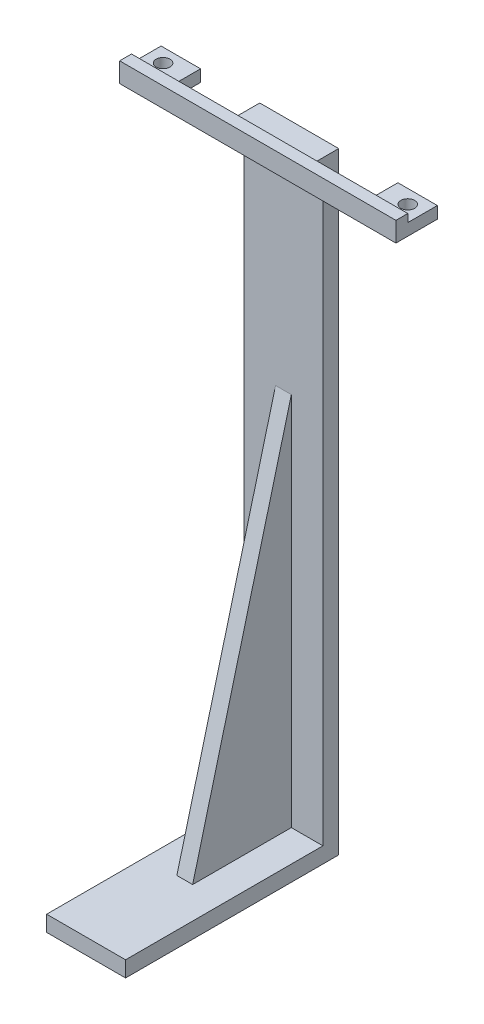
from build123d import *

# Parameters (mm, degrees)
SKETCH1_W           = 20
SKETCH1_H           = 155
BOSS_EXTRUDE1_DEPTH = 4
SKETCH2_W           = 20
SKETCH2_H           = 4
BOSS_EXTRUDE3_DEPTH = 50
RIB2_REACH          = 96.986
SKETCH7_WALL_W      = 290.205463948
SKETCH7_WALL_H      = 4
SKETCH8_W           = 20
SKETCH8_H           = 3
BOSS_EXTRUDE4_DEPTH = 3.5
SKETCH9_W           = 70
SKETCH9_H           = 5
BOSS_EXTRUDE6_DEPTH = 3
SKETCH10_W          = 10
SKETCH10_H          = 3
BOSS_EXTRUDE7_DEPTH = 7.5
SKETCH12_R          = 1.75
CUT_EXTRUDE1_DEPTH  = 10


with BuildPart() as part:
    # Sketch1 → Boss-Extrude1 (new body)
    with BuildSketch(Plane.XY):
        Rectangle(SKETCH1_W, SKETCH1_H)
    extrude(amount=BOSS_EXTRUDE1_DEPTH)

    # Sketch2 → Boss-Extrude3 (add)
    with BuildSketch(Plane.XY.offset(4)):
        with Locations((0, -75.5)):
            Rectangle(SKETCH2_W, SKETCH2_H)
    extrude(amount=BOSS_EXTRUDE3_DEPTH)

    # Sketch7 wall → Rib2 (add, up to next)
    with BuildSketch(Plane(origin=(0, -26, 16.5), x_dir=(0, 0.967074537263, -0.25449329928), z_dir=(0, 0.25449329928, 0.967074537263)), mode=Mode.PRIVATE) as rib2_sk1:
        Rectangle(SKETCH7_WALL_W, SKETCH7_WALL_H)
    rib2_tool1 = extrude(rib2_sk1.sketch, amount=-RIB2_REACH, mode=Mode.PRIVATE) - part.part
    add(rib2_tool1.solids().sort_by_distance((0, -26, 16.5))[0])

    # Sketch8 → Boss-Extrude4 (add)
    with BuildSketch(Plane.XY.offset(4)):
        with Locations((0, 76)):
            Rectangle(SKETCH8_W, SKETCH8_H)
    extrude(amount=BOSS_EXTRUDE4_DEPTH)

    # Sketch9 → Boss-Extrude6 (add)
    with BuildSketch(Plane.XY.offset(7.5)):
        with Locations((0, 77)):
            Rectangle(SKETCH9_W, SKETCH9_H)
    extrude(amount=BOSS_EXTRUDE6_DEPTH)

    # Sketch10 → Boss-Extrude7 (add)
    with BuildSketch(Plane(origin=(0, 0, 7.5), x_dir=(-1, 0, 0), z_dir=(0, 0, -1))):
        with Locations((30, 76)):
            Rectangle(SKETCH10_W, SKETCH10_H)
        with Locations((-30, 76)):
            Rectangle(SKETCH10_W, SKETCH10_H)
    extrude(amount=BOSS_EXTRUDE7_DEPTH)

    # Sketch12 → Cut-Extrude1 (cut)
    with BuildSketch(Plane(origin=(0, 77.5, 0), x_dir=(1, 0, 0), z_dir=(0, 1, 0))):
        with Locations(Location((-31, -3.5, 0), (0, 0, 270))):
            Circle(SKETCH12_R)
        with Locations(Location((31, -3.5, 0), (0, 0, 270))):
            Circle(SKETCH12_R)
    extrude(amount=-CUT_EXTRUDE1_DEPTH, mode=Mode.SUBTRACT)


solid = part.part
